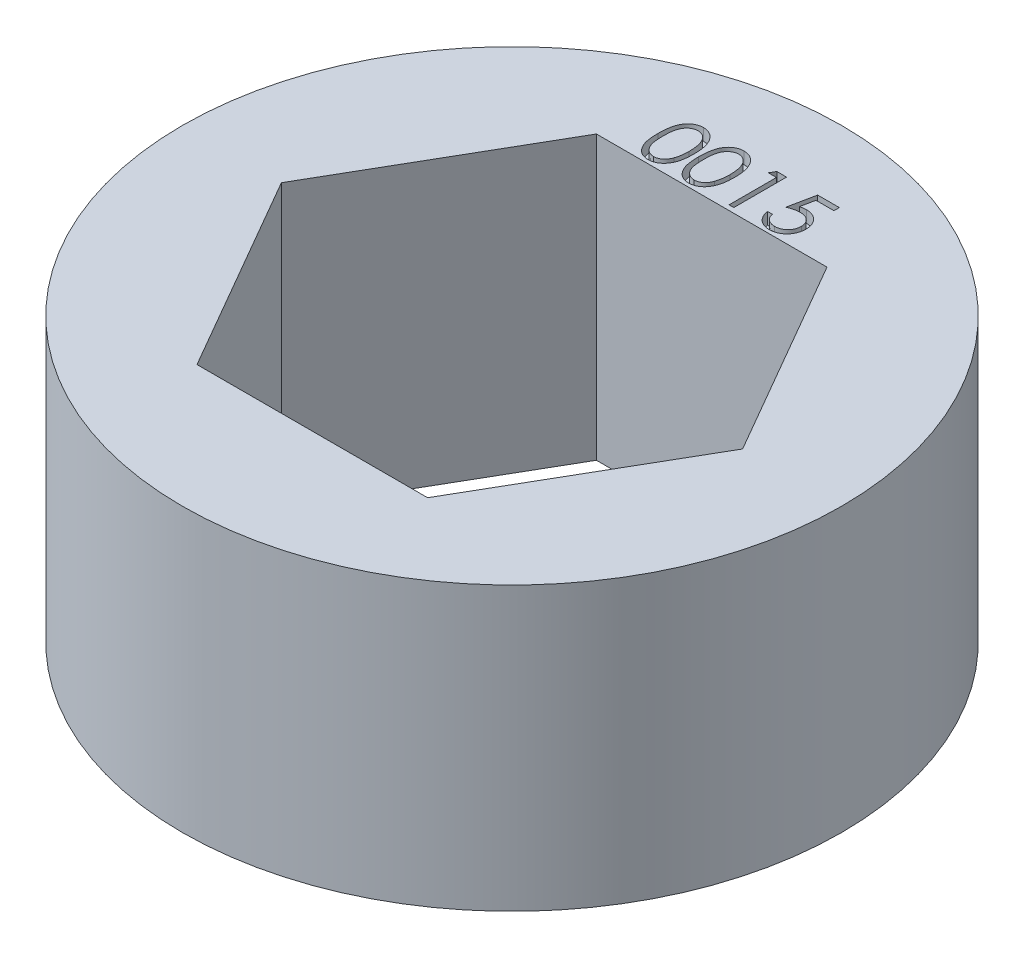
from build123d import *

# Parameters (mm, degrees)
SKETCH1_R           = 11.1125
BOSS_EXTRUDE1_DEPTH = 9.525
CUT_EXTRUDE1_DEPTH  = 0.4


with BuildPart() as part:
    # Sketch1 → Boss-Extrude1 (new body)
    with BuildSketch(Plane(origin=(0, 0, 0), x_dir=(1, 0, 0), z_dir=(0, 1, 0))):
        with Locations(Location((0, 0, 0), (0, 0, 90))):
            Circle(SKETCH1_R)
        Polygon((7.772289324, 0), (3.886144662, 6.731), (-3.886144662, 6.731), (-7.772289324, 0), (-3.886144662, -6.731), (3.886144662, -6.731), align=None, mode=Mode.SUBTRACT)
    extrude(amount=BOSS_EXTRUDE1_DEPTH)

    # Sketch2 → Cut-Extrude1 (cut)
    # profile 1 of 4: a face of its own
    with BuildSketch(Plane(origin=(0, 9.525, 0), x_dir=(1, 0, 0), z_dir=(0, 1, 0))):
        with BuildLine():
            add(Edge.make_bspline(
                [(-2.864554752, 7.787100414), (-2.864388119, 7.815597887), (-2.864064431, 7.870954639), (-2.860463514, 7.951617237), (-2.85448164, 8.027289064), (-2.846283854, 8.097973741), (-2.83630776, 8.163689518), (-2.822990293, 8.224260774), (-2.807845389, 8.279967855), (-2.790292747, 8.330992415), (-2.77048695, 8.378021888), (-2.748930346, 8.421925891), (-2.72476743, 8.462637992), (-2.699379158, 8.50080799), (-2.671737826, 8.535811067), (-2.64263004, 8.568141539), (-2.610919727, 8.597052201), (-2.577684839, 8.623390122), (-2.542624475, 8.646478454), (-2.506738001, 8.666815085), (-2.469778407, 8.684188618), (-2.431644786, 8.697848959), (-2.392679887, 8.709132069), (-2.352747497, 8.716848055), (-2.311781684, 8.721702964), (-2.284130515, 8.722167107), (-2.270107236, 8.722402497)],
                knots=[0, 0, 0, 0, 1.646270934, 3.197905019, 4.663502075, 6.030701355, 7.308322542, 8.50163776, 9.611534131, 10.641858119, 11.616356847, 12.558055219, 13.465016945, 14.349605745, 15.204443733, 16.039544428, 16.859896111, 17.680448484, 18.487036065, 19.28249412, 20.06191084, 20.843045899, 21.620316918, 22.403196591, 23.190181807, 24, 24, 24, 24], degree=3))
            add(Edge.make_bspline(
                [(-2.270107236, 8.722402497), (-2.255966813, 8.722154687), (-2.22784596, 8.721661871), (-2.18627105, 8.716925308), (-2.145656612, 8.709065978), (-2.106175797, 8.697930122), (-2.067504304, 8.684114719), (-2.029944609, 8.666798463), (-1.993263411, 8.646641599), (-1.958043625, 8.622956669), (-1.923898601, 8.596549673), (-1.891667036, 8.566698237), (-1.861345996, 8.533703779), (-1.832554941, 8.497919313), (-1.806110697, 8.45865849), (-1.780927394, 8.416604162), (-1.7583864, 8.371020882), (-1.736677185, 8.322669205), (-1.717938595, 8.270211266), (-1.701039343, 8.213942768), (-1.687384827, 8.153199081), (-1.676011076, 8.088298908), (-1.667199869, 8.019003907), (-1.660782487, 7.945462618), (-1.65739256, 7.86762666), (-1.656754156, 7.814409673), (-1.656426547, 7.787100414)],
                knots=[0, 0, 0, 0, 0.810914788, 1.612654377, 2.396697861, 3.181598691, 3.963628158, 4.749916497, 5.551656086, 6.361998678, 7.18212741, 8.025565596, 8.878627764, 9.750805457, 10.657531673, 11.591944965, 12.560506719, 13.57287815, 14.630710178, 15.753379473, 16.941251878, 18.199788006, 19.531962791, 20.947069417, 22.433333509, 24, 24, 24, 24], degree=3))
            add(Edge.make_bspline(
                [(-1.656426547, 7.787100414), (-1.656757552, 7.759910269), (-1.657402502, 7.70693138), (-1.660744485, 7.629445644), (-1.667327469, 7.556294638), (-1.675562143, 7.487302923), (-1.686967232, 7.422757653), (-1.700990657, 7.362435473), (-1.716561021, 7.306075885), (-1.735781096, 7.2541406), (-1.756817737, 7.205905125), (-1.779705777, 7.160862214), (-1.804226849, 7.118613737), (-1.830941931, 7.079497866), (-1.859417065, 7.043237508), (-1.890261702, 7.010472716), (-1.922606359, 6.980414014), (-1.956851866, 6.953666987), (-1.992620934, 6.930255907), (-2.029176145, 6.909319271), (-2.067166104, 6.892437062), (-2.105729884, 6.877941261), (-2.145419094, 6.866866631), (-2.18618426, 6.859209113), (-2.227818028, 6.853838614), (-2.255962023, 6.853428922), (-2.270107236, 6.85322301)],
                knots=[0, 0, 0, 0, 1.561518951, 3.042555995, 4.452378317, 5.7783523, 7.031515105, 8.214008947, 9.334062868, 10.386615937, 11.391082383, 12.354592575, 13.286541444, 14.194233754, 15.072674879, 15.931287219, 16.775624067, 17.606195743, 18.42308326, 19.229000347, 20.022332153, 20.807536673, 21.593273796, 22.3848459, 23.188221202, 24, 24, 24, 24], degree=3))
            add(Edge.make_bspline(
                [(-2.270107236, 6.85322301), (-2.284130126, 6.853459919), (-2.311780528, 6.853927056), (-2.35275196, 6.858760032), (-2.392519441, 6.866530147), (-2.431279208, 6.877409782), (-2.469230118, 6.890726919), (-2.505855031, 6.90807699), (-2.541561175, 6.928058697), (-2.576253285, 6.950814772), (-2.609279463, 6.976886187), (-2.640825555, 7.005722445), (-2.670099064, 7.038043138), (-2.697345185, 7.073337923), (-2.723240022, 7.11128209), (-2.747059823, 7.152393704), (-2.769092217, 7.19650975), (-2.78923111, 7.243915248), (-2.807086631, 7.295301952), (-2.822858867, 7.351257734), (-2.835312059, 7.412276478), (-2.845971401, 7.4778681), (-2.854568987, 7.548314457), (-2.860438584, 7.623653792), (-2.864066372, 7.703839158), (-2.864388988, 7.758840204), (-2.864554752, 7.787100414)],
                knots=[0, 0, 0, 0, 0.810891512, 1.598919785, 2.382837074, 3.152667961, 3.926044502, 4.706494248, 5.493654104, 6.291793342, 7.103789334, 7.925228297, 8.761435821, 9.622817696, 10.50288917, 11.416980706, 12.369136599, 13.353924996, 14.394355917, 15.514179734, 16.714354668, 17.994756427, 19.357759367, 20.818452758, 22.365282078, 24, 24, 24, 24], degree=3))
        make_face()
        with BuildLine():
            add(Edge.make_bspline(
                [(-2.70499065, 7.787812754), (-2.70492997, 7.764064415), (-2.704812204, 7.717973552), (-2.701735654, 7.650997175), (-2.697544536, 7.588528248), (-2.692138757, 7.530487452), (-2.68411086, 7.477071245), (-2.675115811, 7.427912246), (-2.664169382, 7.38327061), (-2.651217913, 7.342840002), (-2.636466052, 7.305934275), (-2.620359473, 7.271592858), (-2.603056626, 7.239410074), (-2.583692097, 7.209675001), (-2.562602445, 7.18229067), (-2.540264029, 7.156772391), (-2.515843157, 7.134015525), (-2.482059255, 7.106722282), (-2.437458646, 7.078518562), (-2.381263455, 7.053958749), (-2.323519882, 7.038524461), (-2.284327047, 7.036561673), (-2.264764688, 7.035581984)],
                knots=[0, 0, 0, 0, 1.459021318, 2.831673884, 4.118529203, 5.306027144, 6.411944654, 7.436330062, 8.375795394, 9.233974572, 10.042671642, 10.816086306, 11.563610507, 12.285937304, 12.993564865, 13.685989202, 14.367179055, 15.041617293, 16.353048772, 17.594441528, 18.799311195, 20, 20, 20, 20], degree=3))
            add(Edge.make_bspline(
                [(-2.264764688, 7.035581984), (-2.245075791, 7.036393657), (-2.205738647, 7.038015327), (-2.148266679, 7.053661085), (-2.092472901, 7.077267611), (-2.048748356, 7.105180944), (-2.015483224, 7.131763735), (-1.991649393, 7.154427977), (-1.969773872, 7.179805557), (-1.949026098, 7.2071864), (-1.929996888, 7.237093622), (-1.912692814, 7.26938341), (-1.896902473, 7.304145432), (-1.887906278, 7.32841246), (-1.883306755, 7.340819565)],
                knots=[0, 0, 0, 0, 1.353760809, 2.704726607, 4.075137775, 5.516104923, 6.260822281, 7.007110065, 7.778089737, 8.566572457, 9.372053459, 10.217411131, 11.088608312, 12, 12, 12, 12], degree=3))
            add(Edge.make_bspline(
                [(-1.883306755, 7.340819565), (-1.877946457, 7.356684272), (-1.867062753, 7.388896432), (-1.853035972, 7.438865168), (-1.841989309, 7.491292172), (-1.83205112, 7.545864131), (-1.825267767, 7.602983499), (-1.819807878, 7.662473542), (-1.816591889, 7.724379114), (-1.816193235, 7.76643897), (-1.81599065, 7.787812754)],
                knots=[0, 0, 0, 0, 0.884706709, 1.796334032, 2.740027952, 3.714592787, 4.726048262, 5.777819803, 6.87074269, 8, 8, 8, 8], degree=3))
            add(Edge.make_bspline(
                [(-1.81599065, 7.787812754), (-1.816270146, 7.809183081), (-1.8168169, 7.850988008), (-1.818906806, 7.912211244), (-1.824303581, 7.970360867), (-1.830297534, 8.025687387), (-1.839135322, 8.07788454), (-1.848664288, 8.127389296), (-1.861466504, 8.173588352), (-1.87514175, 8.21720502), (-1.89079343, 8.257743752), (-1.908022623, 8.295393556), (-1.926423277, 8.330336196), (-1.946409135, 8.362475802), (-1.967742942, 8.391956334), (-1.990987777, 8.418186708), (-2.015221598, 8.441979888), (-2.049164729, 8.469138873), (-2.093601668, 8.496830814), (-2.148895257, 8.52231502), (-2.206436744, 8.536949633), (-2.245336059, 8.53901297), (-2.264764688, 8.540043523)],
                knots=[0, 0, 0, 0, 1.31362396, 2.569729283, 3.763502607, 4.902122613, 5.988968491, 7.01645872, 7.998833611, 8.933434873, 9.825090667, 10.667526885, 11.477055099, 12.250526234, 12.991942729, 13.710640831, 14.402115721, 15.076753259, 16.378508321, 17.609869233, 18.806226677, 20, 20, 20, 20], degree=3))
            add(Edge.make_bspline(
                [(-2.264764688, 8.540043523), (-2.284429669, 8.539011548), (-2.323795455, 8.536945718), (-2.381935016, 8.522369545), (-2.437664827, 8.496962959), (-2.481984258, 8.469047154), (-2.515951062, 8.442459291), (-2.53986907, 8.419402973), (-2.562295325, 8.394182675), (-2.582954517, 8.366546503), (-2.602303873, 8.336846096), (-2.620074227, 8.304847804), (-2.636085031, 8.270389471), (-2.650859975, 8.233500321), (-2.663850951, 8.193073202), (-2.674566685, 8.148486553), (-2.684466108, 8.099483912), (-2.691474104, 8.045778402), (-2.697704092, 7.987723068), (-2.701707817, 7.92509819), (-2.704822496, 7.858009485), (-2.704933476, 7.811680312), (-2.70499065, 7.787812754)],
                knots=[0, 0, 0, 0, 1.207732386, 2.417664972, 3.655092373, 4.956220595, 5.625982001, 6.301752483, 6.994047911, 7.697131622, 8.419323945, 9.170223765, 9.943494443, 10.752040957, 11.610060368, 12.549350801, 13.567764191, 14.679664412, 15.874934091, 17.154273443, 18.533957287, 20, 20, 20, 20], degree=3))
        make_face(mode=Mode.SUBTRACT)
    # profile 2 of 4: a face of its own
    with BuildSketch(Plane(origin=(0, 9.525, 0), x_dir=(1, 0, 0), z_dir=(0, 1, 0))):
        with BuildLine():
            add(Edge.make_bspline(
                [(-1.496862444, 7.787100414), (-1.496695811, 7.815597887), (-1.496372124, 7.870954639), (-1.492771206, 7.951617237), (-1.486789332, 8.027289064), (-1.478591547, 8.097973741), (-1.468615453, 8.163689518), (-1.455297985, 8.224260774), (-1.440153082, 8.279967855), (-1.422600439, 8.330992415), (-1.402794642, 8.378021888), (-1.381238038, 8.421925891), (-1.357075122, 8.462637992), (-1.331686851, 8.50080799), (-1.304045518, 8.535811067), (-1.274937733, 8.568141539), (-1.24322742, 8.597052201), (-1.209992531, 8.623390122), (-1.174932167, 8.646478454), (-1.139045693, 8.666815085), (-1.102086099, 8.684188618), (-1.063952478, 8.697848959), (-1.024987579, 8.709132069), (-0.985055189, 8.716848055), (-0.944089376, 8.721702964), (-0.916438207, 8.722167107), (-0.902414928, 8.722402497)],
                knots=[0, 0, 0, 0, 1.646270934, 3.197905019, 4.663502075, 6.030701355, 7.308322542, 8.50163776, 9.611534131, 10.641858119, 11.616356847, 12.558055219, 13.465016945, 14.349605745, 15.204443733, 16.039544428, 16.859896111, 17.680448484, 18.487036065, 19.28249412, 20.06191084, 20.843045899, 21.620316918, 22.403196591, 23.190181807, 24, 24, 24, 24], degree=3))
            add(Edge.make_bspline(
                [(-0.902414928, 8.722402497), (-0.888274505, 8.722154687), (-0.860153653, 8.721661871), (-0.818578742, 8.716925308), (-0.777964304, 8.709065978), (-0.738483489, 8.697930122), (-0.699811996, 8.684114719), (-0.662252301, 8.666798463), (-0.625571104, 8.646641599), (-0.590351318, 8.622956669), (-0.556206293, 8.596549673), (-0.523974728, 8.566698237), (-0.493653688, 8.533703779), (-0.464862633, 8.497919313), (-0.43841839, 8.45865849), (-0.413235086, 8.416604162), (-0.390694092, 8.371020882), (-0.368984877, 8.322669205), (-0.350246288, 8.270211266), (-0.333347035, 8.213942768), (-0.319692519, 8.153199081), (-0.308318769, 8.088298908), (-0.299507562, 8.019003907), (-0.293090179, 7.945462618), (-0.289700252, 7.86762666), (-0.289061848, 7.814409673), (-0.288734239, 7.787100414)],
                knots=[0, 0, 0, 0, 0.810914788, 1.612654377, 2.396697861, 3.181598691, 3.963628158, 4.749916497, 5.551656086, 6.361998678, 7.18212741, 8.025565596, 8.878627764, 9.750805457, 10.657531673, 11.591944965, 12.560506719, 13.57287815, 14.630710178, 15.753379473, 16.941251878, 18.199788006, 19.531962791, 20.947069417, 22.433333509, 24, 24, 24, 24], degree=3))
            add(Edge.make_bspline(
                [(-0.288734239, 7.787100414), (-0.289065244, 7.759910269), (-0.289710194, 7.70693138), (-0.293052177, 7.629445644), (-0.299635162, 7.556294638), (-0.307869836, 7.487302923), (-0.319274925, 7.422757653), (-0.333298349, 7.362435473), (-0.348868713, 7.306075885), (-0.368088789, 7.2541406), (-0.38912543, 7.205905125), (-0.412013469, 7.160862214), (-0.436534541, 7.118613737), (-0.463249623, 7.079497866), (-0.491724757, 7.043237508), (-0.522569394, 7.010472716), (-0.554914051, 6.980414014), (-0.589159558, 6.953666987), (-0.624928626, 6.930255907), (-0.661483837, 6.909319271), (-0.699473796, 6.892437062), (-0.738037576, 6.877941261), (-0.777726786, 6.866866631), (-0.818491953, 6.859209113), (-0.860125721, 6.853838614), (-0.888269716, 6.853428922), (-0.902414928, 6.85322301)],
                knots=[0, 0, 0, 0, 1.561518951, 3.042555995, 4.452378317, 5.7783523, 7.031515105, 8.214008947, 9.334062868, 10.386615937, 11.391082383, 12.354592575, 13.286541444, 14.194233754, 15.072674879, 15.931287219, 16.775624067, 17.606195743, 18.42308326, 19.229000347, 20.022332153, 20.807536673, 21.593273796, 22.3848459, 23.188221202, 24, 24, 24, 24], degree=3))
            add(Edge.make_bspline(
                [(-0.902414928, 6.85322301), (-0.916437818, 6.853459919), (-0.94408822, 6.853927056), (-0.985059652, 6.858760032), (-1.024827133, 6.866530147), (-1.063586901, 6.877409782), (-1.10153781, 6.890726919), (-1.138162724, 6.90807699), (-1.173868867, 6.928058697), (-1.208560978, 6.950814772), (-1.241587155, 6.976886187), (-1.273133247, 7.005722445), (-1.302406757, 7.038043138), (-1.329652877, 7.073337923), (-1.355547714, 7.11128209), (-1.379367516, 7.152393704), (-1.401399909, 7.19650975), (-1.421538803, 7.243915248), (-1.439394324, 7.295301952), (-1.45516656, 7.351257734), (-1.467619752, 7.412276478), (-1.478279093, 7.4778681), (-1.486876679, 7.548314457), (-1.492746277, 7.623653792), (-1.496374065, 7.703839158), (-1.49669668, 7.758840204), (-1.496862444, 7.787100414)],
                knots=[0, 0, 0, 0, 0.810891512, 1.598919785, 2.382837074, 3.152667961, 3.926044502, 4.706494248, 5.493654104, 6.291793342, 7.103789334, 7.925228297, 8.761435821, 9.622817696, 10.50288917, 11.416980706, 12.369136599, 13.353924996, 14.394355917, 15.514179734, 16.714354668, 17.994756427, 19.357759367, 20.818452758, 22.365282078, 24, 24, 24, 24], degree=3))
        make_face()
        with BuildLine():
            add(Edge.make_bspline(
                [(-1.337298342, 7.787812754), (-1.337237663, 7.764064415), (-1.337119896, 7.717973552), (-1.334043347, 7.650997175), (-1.329852229, 7.588528248), (-1.32444645, 7.530487452), (-1.316418552, 7.477071245), (-1.307423504, 7.427912246), (-1.296477074, 7.38327061), (-1.283525605, 7.342840002), (-1.268773744, 7.305934275), (-1.252667165, 7.271592858), (-1.235364318, 7.239410074), (-1.215999789, 7.209675001), (-1.194910137, 7.18229067), (-1.172571722, 7.156772391), (-1.148150849, 7.134015525), (-1.114366948, 7.106722282), (-1.069766339, 7.078518562), (-1.013571147, 7.053958749), (-0.955827574, 7.038524461), (-0.916634739, 7.036561673), (-0.89707238, 7.035581984)],
                knots=[0, 0, 0, 0, 1.459021318, 2.831673884, 4.118529203, 5.306027144, 6.411944654, 7.436330062, 8.375795394, 9.233974572, 10.042671642, 10.816086306, 11.563610507, 12.285937304, 12.993564865, 13.685989202, 14.367179055, 15.041617293, 16.353048772, 17.594441528, 18.799311195, 20, 20, 20, 20], degree=3))
            add(Edge.make_bspline(
                [(-0.89707238, 7.035581984), (-0.877383483, 7.036393657), (-0.838046339, 7.038015327), (-0.780574371, 7.053661085), (-0.724780594, 7.077267611), (-0.681056048, 7.105180944), (-0.647790916, 7.131763735), (-0.623957085, 7.154427977), (-0.602081564, 7.179805557), (-0.58133379, 7.2071864), (-0.56230458, 7.237093622), (-0.545000506, 7.26938341), (-0.529210165, 7.304145432), (-0.52021397, 7.32841246), (-0.515614448, 7.340819565)],
                knots=[0, 0, 0, 0, 1.353760809, 2.704726607, 4.075137775, 5.516104923, 6.260822281, 7.007110065, 7.778089737, 8.566572457, 9.372053459, 10.217411131, 11.088608312, 12, 12, 12, 12], degree=3))
            add(Edge.make_bspline(
                [(-0.515614448, 7.340819565), (-0.51025415, 7.356684272), (-0.499370446, 7.388896432), (-0.485343664, 7.438865168), (-0.474297002, 7.491292172), (-0.464358812, 7.545864131), (-0.457575459, 7.602983499), (-0.45211557, 7.662473542), (-0.448899581, 7.724379114), (-0.448500928, 7.76643897), (-0.448298342, 7.787812754)],
                knots=[0, 0, 0, 0, 0.884706709, 1.796334032, 2.740027952, 3.714592787, 4.726048262, 5.777819803, 6.87074269, 8, 8, 8, 8], degree=3))
            add(Edge.make_bspline(
                [(-0.448298342, 7.787812754), (-0.448577838, 7.809183081), (-0.449124592, 7.850988008), (-0.451214498, 7.912211244), (-0.456611274, 7.970360867), (-0.462605226, 8.025687387), (-0.471443014, 8.07788454), (-0.48097198, 8.127389296), (-0.493774196, 8.173588352), (-0.507449442, 8.21720502), (-0.523101123, 8.257743752), (-0.540330316, 8.295393556), (-0.558730969, 8.330336196), (-0.578716827, 8.362475802), (-0.600050634, 8.391956334), (-0.623295469, 8.418186708), (-0.647529291, 8.441979888), (-0.681472421, 8.469138873), (-0.72590936, 8.496830814), (-0.781202949, 8.52231502), (-0.838744437, 8.536949633), (-0.877643751, 8.53901297), (-0.89707238, 8.540043523)],
                knots=[0, 0, 0, 0, 1.31362396, 2.569729283, 3.763502607, 4.902122613, 5.988968491, 7.01645872, 7.998833611, 8.933434873, 9.825090667, 10.667526885, 11.477055099, 12.250526234, 12.991942729, 13.710640831, 14.402115721, 15.076753259, 16.378508321, 17.609869233, 18.806226677, 20, 20, 20, 20], degree=3))
            add(Edge.make_bspline(
                [(-0.89707238, 8.540043523), (-0.916737361, 8.539011548), (-0.956103148, 8.536945718), (-1.014242709, 8.522369545), (-1.069972519, 8.496962959), (-1.11429195, 8.469047154), (-1.148258754, 8.442459291), (-1.172176762, 8.419402973), (-1.194603018, 8.394182675), (-1.215262209, 8.366546503), (-1.234611565, 8.336846096), (-1.252381919, 8.304847804), (-1.268392723, 8.270389471), (-1.283167667, 8.233500321), (-1.296158644, 8.193073202), (-1.306874377, 8.148486553), (-1.3167738, 8.099483912), (-1.323781797, 8.045778402), (-1.330011784, 7.987723068), (-1.334015509, 7.92509819), (-1.337130188, 7.858009485), (-1.337241168, 7.811680312), (-1.337298342, 7.787812754)],
                knots=[0, 0, 0, 0, 1.207732386, 2.417664972, 3.655092373, 4.956220595, 5.625982001, 6.301752483, 6.994047911, 7.697131622, 8.419323945, 9.170223765, 9.943494443, 10.752040957, 11.610060368, 12.549350801, 13.567764191, 14.679664412, 15.874934091, 17.154273443, 18.533957287, 20, 20, 20, 20], degree=3))
        make_face(mode=Mode.SUBTRACT)
    # profile 3 of 4: a face of its own
    with BuildSketch(Plane(origin=(0, 9.525, 0), x_dir=(1, 0, 0), z_dir=(0, 1, 0))):
        Polygon((0.248726097, 8.676812754), (0.577470889, 8.676812754), (0.577470889, 6.898812754), (0.417906786, 6.898812754), (0.417906786, 8.494453779), (0.144368325, 8.494453779), align=None)
    # profile 4 of 4: a face of its own
    with BuildSketch(Plane(origin=(0, 9.525, 0), x_dir=(1, 0, 0), z_dir=(0, 1, 0))):
        with BuildLine():
            Line((2.355470889, 8.676812754), (2.355470889, 8.494453779))
            Line((2.355470889, 8.494453779), (1.750694447, 8.494453779))
            Line((1.750694447, 8.494453779), (1.654884751, 8.026802738))
            add(Edge.make_bspline(
                [(1.654884751, 8.026802738), (1.673709135, 8.031999716), (1.710178402, 8.042068039), (1.764006012, 8.05324697), (1.815106851, 8.059985816), (1.848266739, 8.060905962), (1.864312636, 8.061351215)],
                knots=[0, 0, 0, 0, 1.100273476, 2.13160584, 3.095893838, 4, 4, 4, 4], degree=3))
            add(Edge.make_bspline(
                [(1.864312636, 8.061351215), (1.884167175, 8.06092148), (1.923206161, 8.060076513), (1.980325146, 8.051962813), (2.034850256, 8.039191737), (2.08666746, 8.021350512), (2.13587262, 7.998536367), (2.182013021, 7.970037598), (2.225781241, 7.936746665), (2.266392079, 7.898471399), (2.303234427, 7.856347218), (2.33562755, 7.811055019), (2.363142146, 7.763034967), (2.385271009, 7.711828258), (2.402941451, 7.658001008), (2.414702665, 7.600986856), (2.422534353, 7.541323211), (2.423409325, 7.500528489), (2.423855504, 7.479725815)],
                knots=[0, 0, 0, 0, 1.052922333, 2.070308379, 3.05430497, 4.020497103, 4.973039431, 5.925935799, 6.892292201, 7.88610001, 8.88166317, 9.857072816, 10.836096531, 11.812156883, 12.81219415, 13.836441305, 14.89672472, 16, 16, 16, 16], degree=3))
            add(Edge.make_bspline(
                [(2.423855504, 7.479725815), (2.423517646, 7.465236527), (2.422846495, 7.436453761), (2.419433453, 7.393708507), (2.412862109, 7.351868188), (2.404039305, 7.310927253), (2.392587757, 7.270963212), (2.378724918, 7.231861676), (2.361759736, 7.193866015), (2.343150997, 7.156616715), (2.322197786, 7.120955873), (2.298942304, 7.087606188), (2.274372635, 7.056067373), (2.247935611, 7.026677676), (2.219385506, 6.999630223), (2.189068082, 6.974764496), (2.157225261, 6.951659981), (2.123364398, 6.931254537), (2.088240017, 6.912477356), (2.051344882, 6.897072999), (2.013518847, 6.88330085), (1.97421749, 6.87232321), (1.933529833, 6.863721473), (1.891388807, 6.857879168), (1.848015427, 6.853623937), (1.81861492, 6.853357564), (1.803763758, 6.85322301)],
                knots=[0, 0, 0, 0, 1.056347294, 2.098418968, 3.122841568, 4.141288669, 5.149314143, 6.15115421, 7.162517403, 8.180376062, 9.185164535, 10.17417709, 11.141909838, 12.097768115, 13.052685741, 14.0056014, 14.954263652, 15.917497458, 16.885230207, 17.854509472, 18.828990115, 19.81800267, 20.826176721, 21.857883937, 22.917946725, 24, 24, 24, 24], degree=3))
            add(Edge.make_bspline(
                [(1.803763758, 6.85322301), (1.786047674, 6.853573956), (1.751193372, 6.8542644), (1.700128924, 6.861487391), (1.650997904, 6.87183226), (1.604195813, 6.887395485), (1.559303211, 6.906896231), (1.51692447, 6.931542446), (1.475976736, 6.959471831), (1.438124621, 6.99243105), (1.402993315, 7.028456216), (1.371544809, 7.067550698), (1.343536952, 7.109069255), (1.319418256, 7.153213517), (1.298845262, 7.199867491), (1.282683248, 7.249205975), (1.269638643, 7.300971177), (1.264120026, 7.33660916), (1.261317043, 7.35471019)],
                knots=[0, 0, 0, 0, 1.0467383, 2.05933395, 3.04377827, 4.011590433, 4.970194871, 5.932262533, 6.905835911, 7.896367577, 8.894135286, 9.877477877, 10.858688626, 11.851381753, 12.8477658, 13.868841284, 14.917554742, 16, 16, 16, 16], degree=3))
            Line((1.261317043, 7.35471019), (1.420881145, 7.35471019))
            add(Edge.make_bspline(
                [(1.420881145, 7.35471019), (1.424807252, 7.337754952), (1.432353448, 7.305166043), (1.448917169, 7.259379322), (1.469169034, 7.218577156), (1.493250443, 7.182219808), (1.521977858, 7.150516037), (1.554758808, 7.12226257), (1.591511451, 7.096773604), (1.632351212, 7.075527638), (1.675436256, 7.057407912), (1.720529999, 7.045342051), (1.766404607, 7.036857997), (1.797432419, 7.036008743), (1.813024174, 7.035581984)],
                knots=[0, 0, 0, 0, 1.136247022, 2.183929868, 3.172523383, 4.106158343, 5.02341133, 5.958108904, 6.928429099, 7.938127109, 8.96079061, 9.975095812, 10.982467395, 12, 12, 12, 12], degree=3))
            add(Edge.make_bspline(
                [(1.813024174, 7.035581984), (1.828243064, 7.03599894), (1.858209182, 7.036819928), (1.902309367, 7.043138946), (1.944886307, 7.052870992), (1.985519884, 7.067435279), (2.024921146, 7.085136395), (2.062093422, 7.107851654), (2.098112083, 7.133993343), (2.131857575, 7.163943311), (2.162764015, 7.196947916), (2.190072125, 7.232242432), (2.212818797, 7.26989379), (2.231987724, 7.309250152), (2.2465436, 7.350742859), (2.256927618, 7.394177456), (2.263025172, 7.439661226), (2.263863972, 7.470684435), (2.264291402, 7.486493042)],
                knots=[0, 0, 0, 0, 1.027316725, 2.022795036, 3.002884548, 3.971462791, 4.93288096, 5.914575861, 6.907176829, 7.935150275, 8.956128384, 9.956726525, 10.942570165, 11.921478529, 12.907843606, 13.90538589, 14.932640048, 16, 16, 16, 16], degree=3))
            add(Edge.make_bspline(
                [(2.264291402, 7.486493042), (2.263956894, 7.500755524), (2.263302143, 7.528672303), (2.257952614, 7.5695151), (2.248647592, 7.608160205), (2.235732261, 7.644794236), (2.219334271, 7.679451745), (2.199295544, 7.712168499), (2.175240018, 7.742513287), (2.147761338, 7.770500304), (2.117658254, 7.7963295), (2.084412832, 7.818348296), (2.04872079, 7.836871966), (2.011012153, 7.85285771), (1.970389985, 7.864338888), (1.927658735, 7.872958574), (1.882356968, 7.877944778), (1.851383858, 7.878636618), (1.835462876, 7.878992241)],
                knots=[0, 0, 0, 0, 1.045622112, 2.046656509, 3.013763289, 3.955457236, 4.890082067, 5.820317437, 6.762574623, 7.722996705, 8.69280354, 9.665887285, 10.63943826, 11.638615906, 12.663482002, 13.728887084, 14.832589034, 16, 16, 16, 16], degree=3))
            add(Edge.make_bspline(
                [(1.835462876, 7.878992241), (1.82168138, 7.878697301), (1.793226088, 7.878088324), (1.749577292, 7.873604463), (1.703709097, 7.866370902), (1.655797333, 7.856421088), (1.605698115, 7.843400501), (1.553517167, 7.827797535), (1.499144776, 7.809142759), (1.462508972, 7.795054795), (1.443676017, 7.787812754)],
                knots=[0, 0, 0, 0, 0.817624296, 1.688186739, 2.600797293, 3.572016777, 4.590301741, 5.671205678, 6.80286297, 8, 8, 8, 8], degree=3))
            Line((1.443676017, 7.787812754), (1.626034991, 8.676812754))
            Line((1.626034991, 8.676812754), (2.355470889, 8.676812754))
        make_face()
    extrude(amount=-CUT_EXTRUDE1_DEPTH, mode=Mode.SUBTRACT)


solid = part.part
